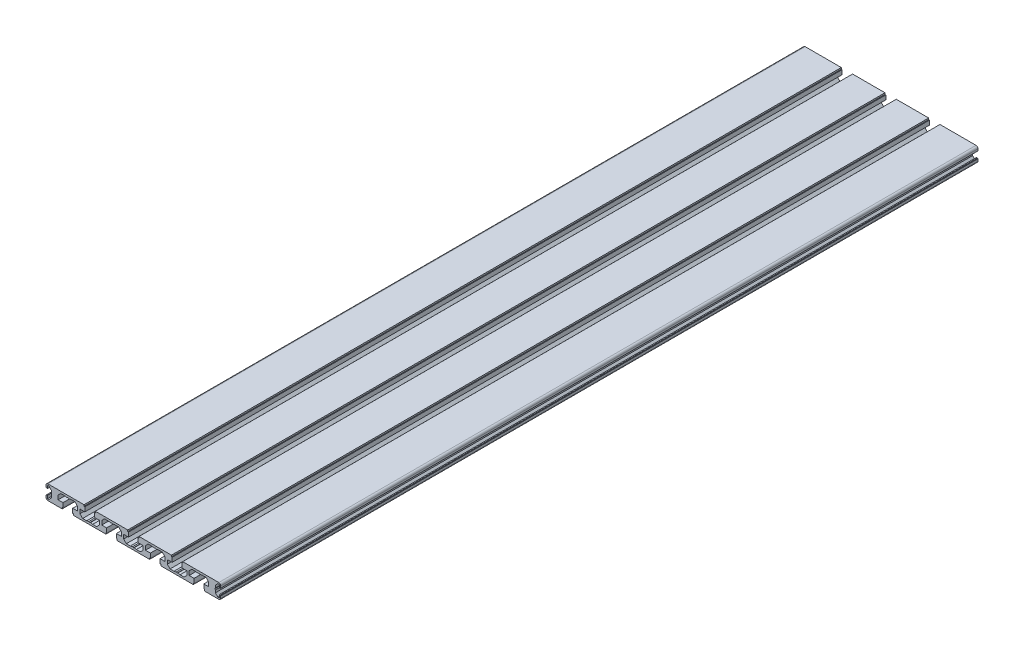
from build123d import *

# Parameters (mm, degrees)
EXTRUDE_531_DEPTH = 390


with BuildPart() as part:
    # Model → Extrude 531 (new, symmetric)
    with BuildSketch(Plane.XY):
        with BuildLine():
            Line((-87.100000001, -7.500000002), (-72.400000001, -7.500000002))
            Line((-72.400000001, -7.500000002), (-72.400000001, -6.000000002))
            Line((-72.400000001, -6.000000002), (-71.600000001, -6.000000002))
            Line((-71.600000001, -6.000000002), (-71.600000001, -1.500000002))
            Line((-71.600000001, -1.500000002), (-76.650000001, -1.500000002))
            Line((-76.650000001, -1.500000002), (-76.650000001, 2.699999998))
            Line((-76.650000001, 2.699999998), (-73.850000001, 5.499999998))
            Line((-73.850000001, 5.499999998), (-69.722499001, 5.499999998))
            ThreePointArc((-69.722499001, 5.499999998), (-68.624324752, 5.207037765), (-67.500000003, 5.040582344))
            Line((-67.500000003, 5.040582344), (-66.6, 5.560197588))
            Line((-66.6, 5.560197588), (-65.700000001, 5.040582347))
            ThreePointArc((-65.700000001, 5.040582347), (-64.575675254, 5.207037766), (-63.477501008, 5.499999998))
            Line((-63.477501008, 5.499999998), (-59.350000001, 5.499999998))
            Line((-59.350000001, 5.499999998), (-56.550000001, 2.699999998))
            Line((-56.550000001, 2.699999998), (-56.550000001, -1.500000002))
            Line((-56.550000001, -1.500000002), (-61.600000001, -1.500000002))
            Line((-61.600000001, -1.500000002), (-61.600000001, -6.000000002))
            Line((-61.600000001, -6.000000002), (-60.800000001, -6.000000002))
            Line((-60.800000001, -6.000000002), (-60.800000001, -7.500000002))
            Line((-60.800000001, -7.500000002), (-27.400000001, -7.500000002))
            Line((-27.400000001, -7.500000002), (-27.400000001, -6.000000002))
            Line((-27.400000001, -6.000000002), (-26.600000001, -6.000000002))
            Line((-26.600000001, -6.000000002), (-26.600000001, -1.500000002))
            Line((-26.600000001, -1.500000002), (-31.650000001, -1.500000002))
            Line((-31.650000001, -1.500000002), (-31.650000001, 2.699999998))
            Line((-31.650000001, 2.699999998), (-28.850000001, 5.499999998))
            Line((-28.850000001, 5.499999998), (-24.722499001, 5.499999998))
            ThreePointArc((-24.722499001, 5.499999998), (-23.624324752, 5.207037765), (-22.500000003, 5.040582344))
            Line((-22.500000003, 5.040582344), (-21.6, 5.560197588))
            Line((-21.6, 5.560197588), (-20.700000001, 5.040582347))
            ThreePointArc((-20.700000001, 5.040582347), (-19.575675254, 5.207037766), (-18.477501008, 5.499999998))
            Line((-18.477501008, 5.499999998), (-14.350000001, 5.499999998))
            Line((-14.350000001, 5.499999998), (-11.550000001, 2.699999998))
            Line((-11.550000001, 2.699999998), (-11.550000001, -1.500000002))
            Line((-11.550000001, -1.500000002), (-16.600000001, -1.500000002))
            Line((-16.600000001, -1.500000002), (-16.600000001, -6.000000002))
            Line((-16.600000001, -6.000000002), (-15.800000001, -6.000000002))
            Line((-15.800000001, -6.000000002), (-15.800000001, -7.500000002))
            Line((-15.800000001, -7.500000002), (17.599999999, -7.500000002))
            Line((17.599999999, -7.500000002), (17.599999999, -6.000000002))
            Line((17.599999999, -6.000000002), (18.399999999, -6.000000002))
            Line((18.399999999, -6.000000002), (18.399999999, -1.500000002))
            Line((18.399999999, -1.500000002), (13.349999999, -1.500000002))
            Line((13.349999999, -1.500000002), (13.349999999, 2.699999998))
            Line((13.349999999, 2.699999998), (16.149999999, 5.499999998))
            Line((16.149999999, 5.499999998), (20.277500999, 5.499999998))
            ThreePointArc((20.277500999, 5.499999998), (21.375675248, 5.207037765), (22.499999997, 5.040582344))
            Line((22.499999997, 5.040582344), (23.4, 5.560197588))
            Line((23.4, 5.560197588), (24.299999999, 5.040582347))
            ThreePointArc((24.299999999, 5.040582347), (25.424324746, 5.207037766), (26.522498992, 5.499999998))
            Line((26.522498992, 5.499999998), (30.649999999, 5.499999998))
            Line((30.649999999, 5.499999998), (33.449999999, 2.699999998))
            Line((33.449999999, 2.699999998), (33.449999999, -1.500000002))
            Line((33.449999999, -1.500000002), (28.399999999, -1.500000002))
            Line((28.399999999, -1.500000002), (28.399999999, -6.000000002))
            Line((28.399999999, -6.000000002), (29.199999999, -6.000000002))
            Line((29.199999999, -6.000000002), (29.199999999, -7.500000002))
            Line((29.199999999, -7.500000002), (62.599999999, -7.500000002))
            Line((62.599999999, -7.500000002), (62.599999999, -6.000000002))
            Line((62.599999999, -6.000000002), (63.399999999, -6.000000002))
            Line((63.399999999, -6.000000002), (63.399999999, -1.500000002))
            Line((63.399999999, -1.500000002), (58.349999999, -1.500000002))
            Line((58.349999999, -1.500000002), (58.349999999, 2.699999998))
            Line((58.349999999, 2.699999998), (61.149999999, 5.499999998))
            Line((61.149999999, 5.499999998), (65.277500999, 5.499999998))
            ThreePointArc((65.277500999, 5.499999998), (66.375675248, 5.207037765), (67.499999997, 5.040582344))
            Line((67.499999997, 5.040582344), (68.4, 5.560197588))
            Line((68.4, 5.560197588), (69.299999999, 5.040582347))
            ThreePointArc((69.299999999, 5.040582347), (70.424324746, 5.207037766), (71.522498992, 5.499999998))
            Line((71.522498992, 5.499999998), (75.649999999, 5.499999998))
            Line((75.649999999, 5.499999998), (78.449999999, 2.699999998))
            Line((78.449999999, 2.699999998), (78.449999999, -1.500000002))
            Line((78.449999999, -1.500000002), (73.399999999, -1.500000002))
            Line((73.399999999, -1.500000002), (73.399999999, -6.000000002))
            Line((73.399999999, -6.000000002), (74.199999999, -6.000000002))
            Line((74.199999999, -6.000000002), (74.199999999, -7.500000002))
            Line((74.199999999, -7.500000002), (88.899999999, -7.500000002))
            ThreePointArc((88.899999999, -7.500000002), (90.314213561, -6.914213564), (90.899999999, -5.500000002))
            Line((90.899999999, -5.500000002), (90.899999999, -3.500000002))
            Line((90.899999999, -3.500000002), (90.399999999, -3.500000002))
            Line((90.399999999, -3.500000002), (90.399999999, -3.000000002))
            Line((90.399999999, -3.000000002), (89.399999999, -3.000000002))
            Line((89.399999999, -3.000000002), (89.399999999, -6.000000002))
            Line((89.399999999, -6.000000002), (87.949999999, -6.000000002))
            Line((87.949999999, -6.000000002), (85.399999999, -3.450000002))
            Line((85.399999999, -3.450000002), (85.399999999, -0.919615242))
            Line((85.399999999, -0.919615242), (84.869059892, 0))
            Line((84.869059892, 0), (85.399999999, 0.919615242))
            Line((85.399999999, 0.919615242), (85.399999999, 3.450000002))
            Line((85.399999999, 3.450000002), (87.949999999, 6.000000002))
            Line((87.949999999, 6.000000002), (89.399999999, 6.000000002))
            Line((89.399999999, 6.000000002), (89.399999999, 3.000000002))
            Line((89.399999999, 3.000000002), (90.399999999, 3.000000002))
            Line((90.399999999, 3.000000002), (90.399999999, 3.500000002))
            Line((90.399999999, 3.500000002), (90.899999999, 3.500000002))
            Line((90.899999999, 3.500000002), (90.899999999, 5.500000002))
            ThreePointArc((90.899999999, 5.500000002), (90.314213561, 6.914213564), (88.899999999, 7.500000002))
            Line((88.899999999, 7.500000002), (51.7, 7.500000002))
            Line((51.7, 7.500000002), (51.7, 5.999999997))
            Line((51.7, 5.999999997), (50.9, 5.999999997))
            Line((50.9, 5.999999997), (50.9, 1.499999997))
            Line((50.9, 1.499999997), (55.95, 1.499999997))
            Line((55.95, 1.499999997), (55.95, -2.700000003))
            Line((55.95, -2.700000003), (53.15, -5.500000003))
            Line((53.15, -5.500000003), (49.022499, -5.500000003))
            ThreePointArc((49.022499, -5.500000003), (47.924324751, -5.20703777), (46.800000002, -5.040582349))
            Line((46.800000002, -5.040582349), (45.899999999, -5.560197593))
            Line((45.899999999, -5.560197593), (45, -5.040582352))
            ThreePointArc((45, -5.040582352), (43.875675253, -5.207037771), (42.777501007, -5.500000004))
            Line((42.777501007, -5.500000004), (38.65, -5.500000004))
            Line((38.65, -5.500000004), (35.85, -2.700000004))
            Line((35.85, -2.700000004), (35.85, 1.499999996))
            Line((35.85, 1.499999996), (40.9, 1.499999996))
            Line((40.9, 1.499999996), (40.9, 5.999999996))
            Line((40.9, 5.999999996), (40.1, 5.999999996))
            Line((40.1, 5.999999996), (40.1, 7.499999996))
            Line((40.1, 7.499999996), (6.7, 7.499999996))
            Line((6.7, 7.499999996), (6.7, 5.999999997))
            Line((6.7, 5.999999997), (5.9, 5.999999997))
            Line((5.9, 5.999999997), (5.9, 1.499999997))
            Line((5.9, 1.499999997), (10.95, 1.499999997))
            Line((10.95, 1.499999997), (10.95, -2.700000003))
            Line((10.95, -2.700000003), (8.15, -5.500000003))
            Line((8.15, -5.500000003), (4.022499, -5.500000003))
            ThreePointArc((4.022499, -5.500000003), (2.924324751, -5.20703777), (1.800000002, -5.040582349))
            Line((1.800000002, -5.040582349), (0.899999999, -5.560197593))
            Line((0.899999999, -5.560197593), (0, -5.040582352))
            ThreePointArc((0, -5.040582352), (-1.124324747, -5.207037771), (-2.222498993, -5.500000004))
            Line((-2.222498993, -5.500000004), (-6.35, -5.500000004))
            Line((-6.35, -5.500000004), (-9.15, -2.700000003))
            Line((-9.15, -2.700000003), (-9.15, 1.499999997))
            Line((-9.15, 1.499999997), (-4.1, 1.499999997))
            Line((-4.1, 1.499999997), (-4.1, 5.999999997))
            Line((-4.1, 5.999999997), (-4.9, 5.999999997))
            Line((-4.9, 5.999999997), (-4.9, 7.499999997))
            Line((-4.9, 7.499999997), (-38.3, 7.499999997))
            Line((-38.3, 7.499999997), (-38.3, 5.999999997))
            Line((-38.3, 5.999999997), (-39.1, 5.999999997))
            Line((-39.1, 5.999999997), (-39.1, 1.499999997))
            Line((-39.1, 1.499999997), (-34.05, 1.499999997))
            Line((-34.05, 1.499999997), (-34.05, -2.700000003))
            Line((-34.05, -2.700000003), (-36.85, -5.500000003))
            Line((-36.85, -5.500000003), (-40.977501, -5.500000003))
            ThreePointArc((-40.977501, -5.500000003), (-42.075675249, -5.20703777), (-43.199999998, -5.040582349))
            Line((-43.199999998, -5.040582349), (-44.100000001, -5.560197593))
            Line((-44.100000001, -5.560197593), (-45, -5.040582352))
            ThreePointArc((-45, -5.040582352), (-46.124324747, -5.207037771), (-47.222498993, -5.500000004))
            Line((-47.222498993, -5.500000004), (-51.35, -5.500000004))
            Line((-51.35, -5.500000004), (-54.15, -2.700000004))
            Line((-54.15, -2.700000004), (-54.15, 1.499999996))
            Line((-54.15, 1.499999996), (-49.1, 1.499999996))
            Line((-49.1, 1.499999996), (-49.1, 5.999999996))
            Line((-49.1, 5.999999996), (-49.9, 5.999999996))
            Line((-49.9, 5.999999996), (-49.9, 7.499999998))
            Line((-49.9, 7.499999998), (-87.100000001, 7.499999998))
            ThreePointArc((-87.100000001, 7.499999998), (-88.514213563, 6.91421356), (-89.100000001, 5.499999998))
            Line((-89.100000001, 5.499999998), (-89.100000001, 3.499999998))
            Line((-89.100000001, 3.499999998), (-88.600000001, 3.499999998))
            Line((-88.600000001, 3.499999998), (-88.600000001, 2.999999998))
            Line((-88.600000001, 2.999999998), (-87.600000001, 2.999999998))
            Line((-87.600000001, 2.999999998), (-87.600000001, 5.999999998))
            Line((-87.600000001, 5.999999998), (-86.150000001, 5.999999998))
            Line((-86.150000001, 5.999999998), (-83.600000001, 3.449999998))
            Line((-83.600000001, 3.449999998), (-83.600000001, -3.450000002))
            Line((-83.600000001, -3.450000002), (-86.150000001, -6.000000002))
            Line((-86.150000001, -6.000000002), (-87.600000001, -6.000000002))
            Line((-87.600000001, -6.000000002), (-87.600000001, -3.000000002))
            Line((-87.600000001, -3.000000002), (-88.600000001, -3.000000002))
            Line((-88.600000001, -3.000000002), (-88.600000001, -3.500000002))
            Line((-88.600000001, -3.500000002), (-89.100000001, -3.500000002))
            Line((-89.100000001, -3.500000002), (-89.100000001, -5.500000002))
            ThreePointArc((-89.100000001, -5.500000002), (-88.514213563, -6.914213564), (-87.100000001, -7.500000002))
        make_face()
    extrude(amount=EXTRUDE_531_DEPTH, both=True)


solid = part.part
